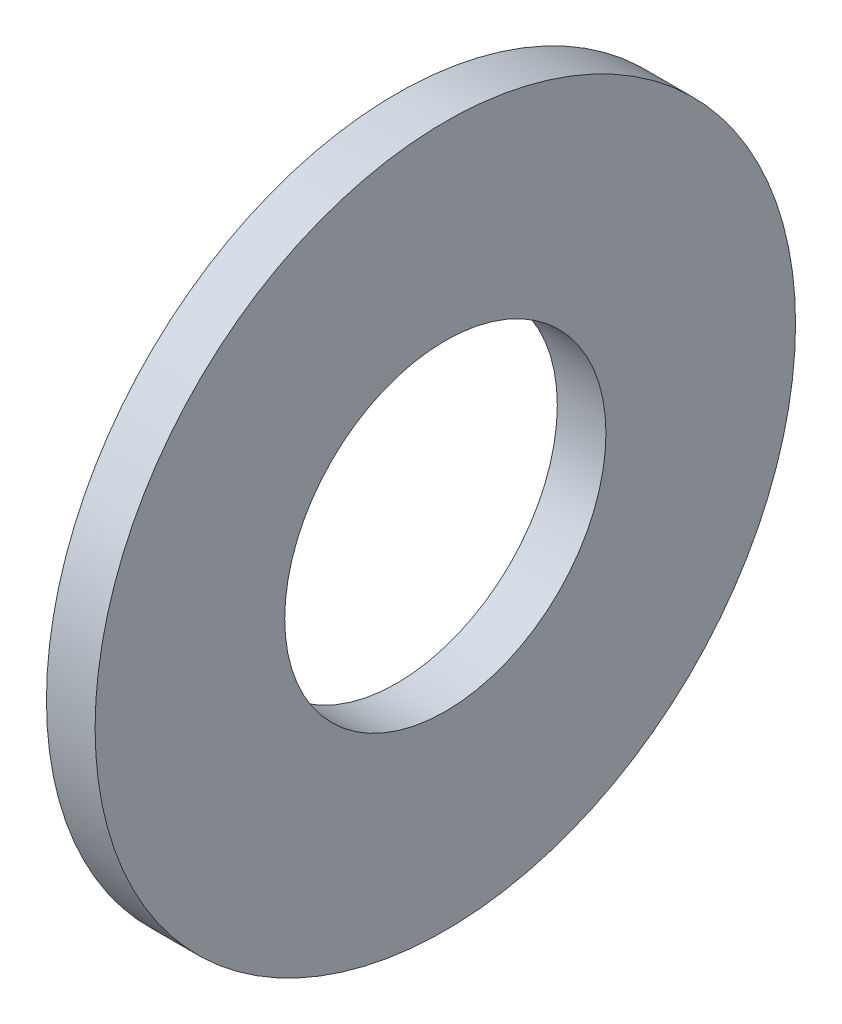
from build123d import *

# Parameters (mm, degrees)
SKETCH1_W = 5
SKETCH1_H = 19.49


with BuildPart() as part:
    # Sketch1 → Base-Revolve (revolve)
    with BuildSketch(Plane.XY, mode=Mode.PRIVATE) as base_revolve_sk:
        with Locations((-2.5, 26.255)):
            Rectangle(SKETCH1_W, SKETCH1_H)
    revolve(base_revolve_sk.sketch.rotate(Axis((-34.925, 0, 0), (1, 0, 0)), 90), axis=Axis((-34.925, 0, 0), (1, 0, 0)))


solid = part.part
